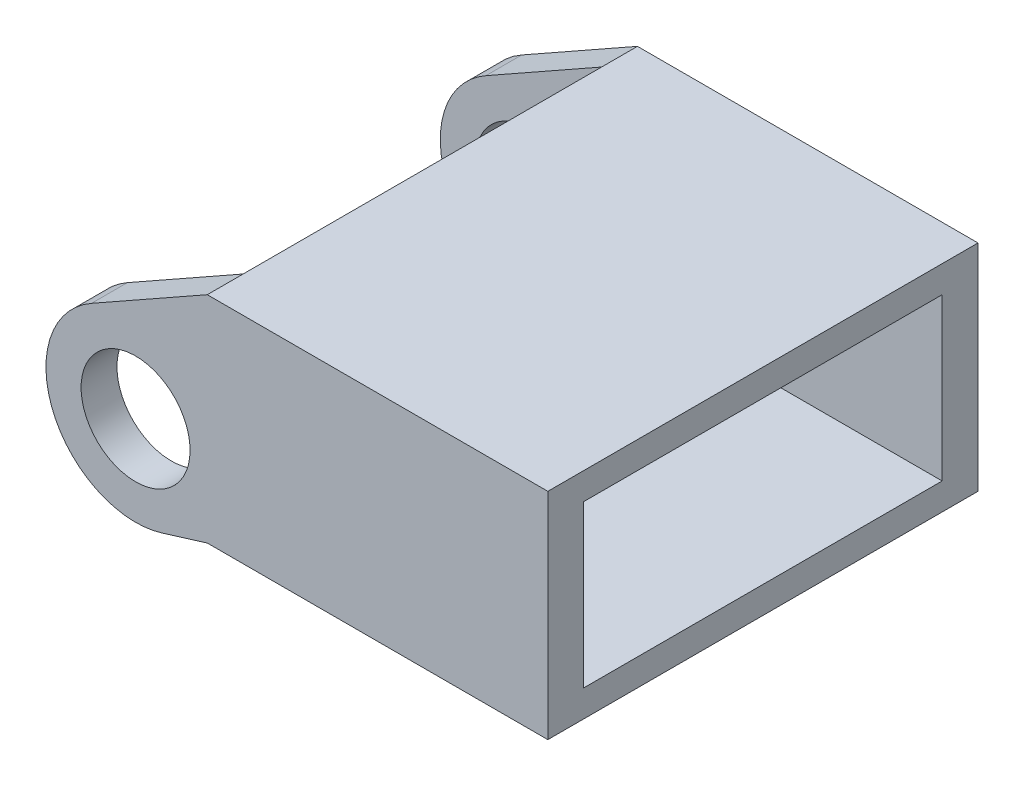
from build123d import *

# Parameters (mm, degrees)
MASS_DEPTH                = 76.2
SKETCH17_W                = 63.5
SKETCH17_H                = 28.575
HOLLOW1_DEPTH             = 124.131068378
SKETCH19_W                = 50.8
SKETCH19_H                = 63.5
HOLLOW2_DEPTH             = 106.589636092
SKETCH20_R                = 9.652
HORIZ_BEARING_MOUNT_DEPTH = 105.389442115


with BuildPart() as part:
    # Sketch2 → Mass (new body)
    with BuildSketch(Plane.XY):
        with BuildLine():
            Line((0, 0), (60.325, 0))
            Line((60.325, 0), (60.325, 38.1))
            Line((60.325, 38.1), (0, 38.1))
            Line((0, 38.1), (-20.504465098, 26.524107549))
            ThreePointArc((-20.504465098, 26.524107549), (-27.282443066, 6.425609255), (-8.028287758, -2.472037758))
            Line((-8.028287758, -2.472037758), (0, 0))
        make_face()
    extrude(amount=MASS_DEPTH)

    # Sketch17 → Hollow1 (cut, through all)
    with BuildSketch(Plane(origin=(60.325, 0, 0), x_dir=(0, 0, -1), z_dir=(1, 0, 0))):
        with Locations((-38.1, 19.05)):
            Rectangle(SKETCH17_W, SKETCH17_H)
    extrude(amount=-HOLLOW1_DEPTH, mode=Mode.SUBTRACT)

    # Sketch19 → Hollow2 (cut, through all)
    with BuildSketch(Plane(origin=(0, 38.1, 0), x_dir=(1, 0, 0), z_dir=(0, 1, 0))):
        with Locations((-25.4, -38.1)):
            Rectangle(SKETCH19_W, SKETCH19_H)
    extrude(amount=-HOLLOW2_DEPTH, mode=Mode.SUBTRACT)

    # Sketch20 → Horiz. Bearing Mount (cut, through all)
    with BuildSketch(Plane.XY.offset(76.2)):
        with Locations((-12.7, 12.7)):
            Circle(SKETCH20_R)
    extrude(amount=-HORIZ_BEARING_MOUNT_DEPTH, mode=Mode.SUBTRACT)


solid = part.part
